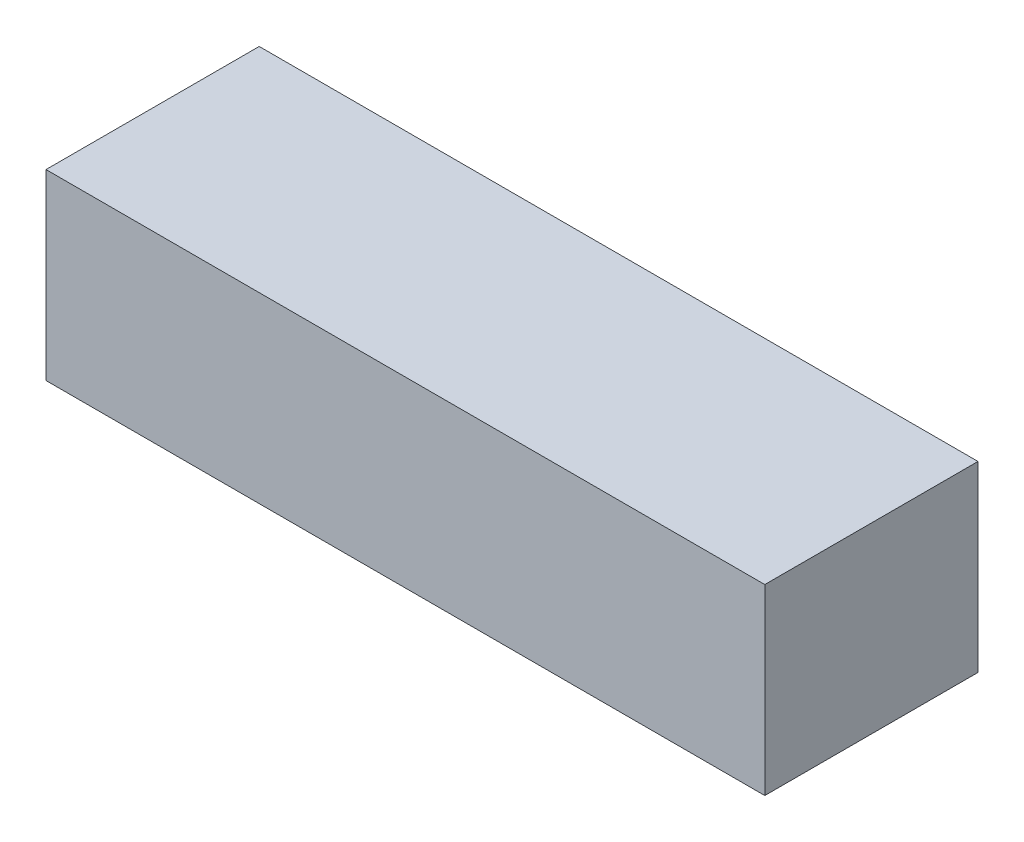
from build123d import *

# Parameters (mm, degrees)
SKETCH_1_W      = 118
SKETCH_1_H      = 30
EXTRUDE_1_DEPTH = 35


with BuildPart() as part:
    # 草图1 → 凸台-拉伸1 (new body)
    with BuildSketch(Plane.XY):
        with Locations((59, -15)):
            Rectangle(SKETCH_1_W, SKETCH_1_H)
    extrude(amount=EXTRUDE_1_DEPTH)


solid = part.part
